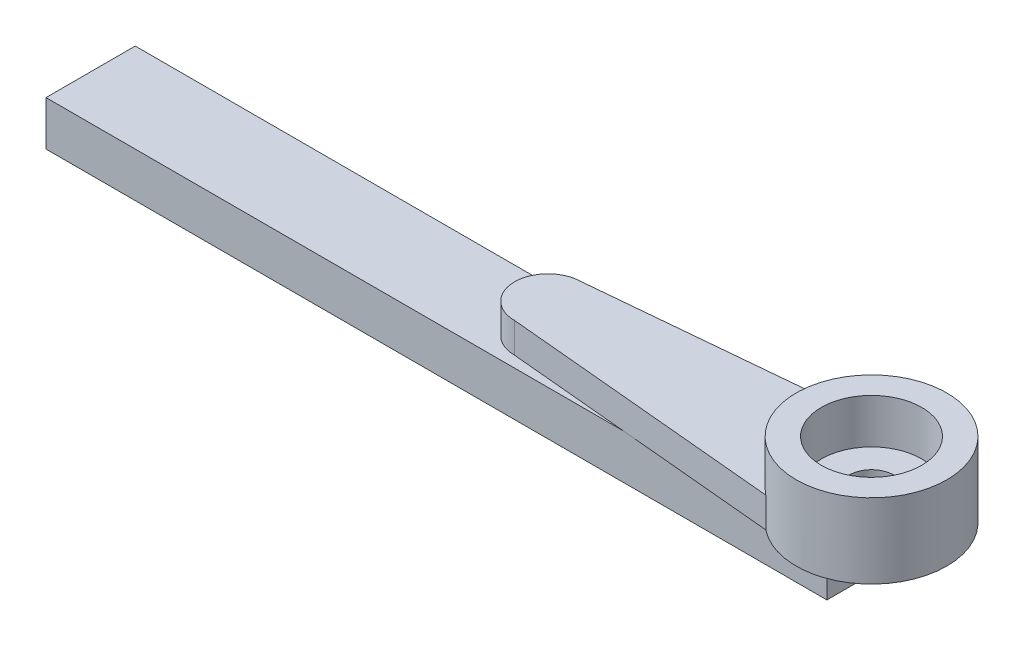
from build123d import *

# Parameters (mm, degrees)
ESTRUSIONE_ESTRUSIONE1_DEPTH = 1.35
SCHIZZO2_R                   = 3.375
ESTRUSIONE_ESTRUSIONE2_DEPTH = 2
SCHIZZO3_R                   = 2.25
TAGLIO_ESTRUSIONE1_DEPTH     = 2
SCHIZZO4_R                   = 1
TAGLIO_ESTRUSIONE2_DEPTH     = 17.47393775
SCHIZZO6_W                   = 35
SCHIZZO6_H                   = 4
ESTRUSIONE_ESTRUSIONE3_DEPTH = 2


with BuildPart() as part:
    # Schizzo1 → Estrusione-Estrusione1 (new body)
    with BuildSketch(Plane(origin=(0, 0, 0), x_dir=(1, 0, 0), z_dir=(0, 1, 0))):
        with BuildLine():
            ThreePointArc((-2.090005981, -2.65), (-3.375, 0), (-2.090005981, 2.65))
            Line((-2.090005981, 2.65), (-14.5, 1.5))
            ThreePointArc((-14.5, 1.5), (-16, 0), (-14.5, -1.5))
            Line((-14.5, -1.5), (-2.090005981, -2.65))
        make_face()
        with BuildLine():
            ThreePointArc((3.375, 0), (1.472558117, 3.036807138), (-2.090005981, 2.65))
            Line((-2.090005981, 2.65), (-2.090005981, -2.65))
            ThreePointArc((-2.090005981, -2.65), (1.472558117, -3.036807138), (3.375, 0))
        make_face()
        with BuildLine():
            Line((-2.090005981, -2.65), (-2.090005981, 2.65))
            ThreePointArc((-2.090005981, 2.65), (-3.375, 0), (-2.090005981, -2.65))
        make_face()
    extrude(amount=ESTRUSIONE_ESTRUSIONE1_DEPTH)

    # Schizzo2 → Estrusione-Estrusione2 (add)
    with BuildSketch(Plane(origin=(0, 1.35, 0), x_dir=(1, 0, 0), z_dir=(0, 1, 0))):
        with Locations(Location((0, 0, 0), (0, 0, 128.262191128))):
            Circle(SCHIZZO2_R)
    extrude(amount=ESTRUSIONE_ESTRUSIONE2_DEPTH)

    # Schizzo3 → Taglio-Estrusione1 (cut)
    with BuildSketch(Plane(origin=(0, 3.35, 0), x_dir=(1, 0, 0), z_dir=(0, 1, 0))):
        with Locations(Location((0, 0, 0), (0, 0, 270))):
            Circle(SCHIZZO3_R)
    extrude(amount=-TAGLIO_ESTRUSIONE1_DEPTH, mode=Mode.SUBTRACT)

    # Schizzo4 → Taglio-Estrusione2 (cut, through all)
    with BuildSketch(Plane(origin=(0, 1.35, 0), x_dir=(1, 0, 0), z_dir=(0, 1, 0))):
        with Locations(Location((0, 0, 0), (0, 0, 270))):
            Circle(SCHIZZO4_R)
    extrude(amount=-TAGLIO_ESTRUSIONE2_DEPTH, mode=Mode.SUBTRACT)

    # Schizzo6 → Estrusione-Estrusione3 (add)
    with BuildSketch(Plane.XZ):
        with Locations((-17.5, 0)):
            Rectangle(SCHIZZO6_W, SCHIZZO6_H)
    extrude(amount=ESTRUSIONE_ESTRUSIONE3_DEPTH)


solid = part.part
